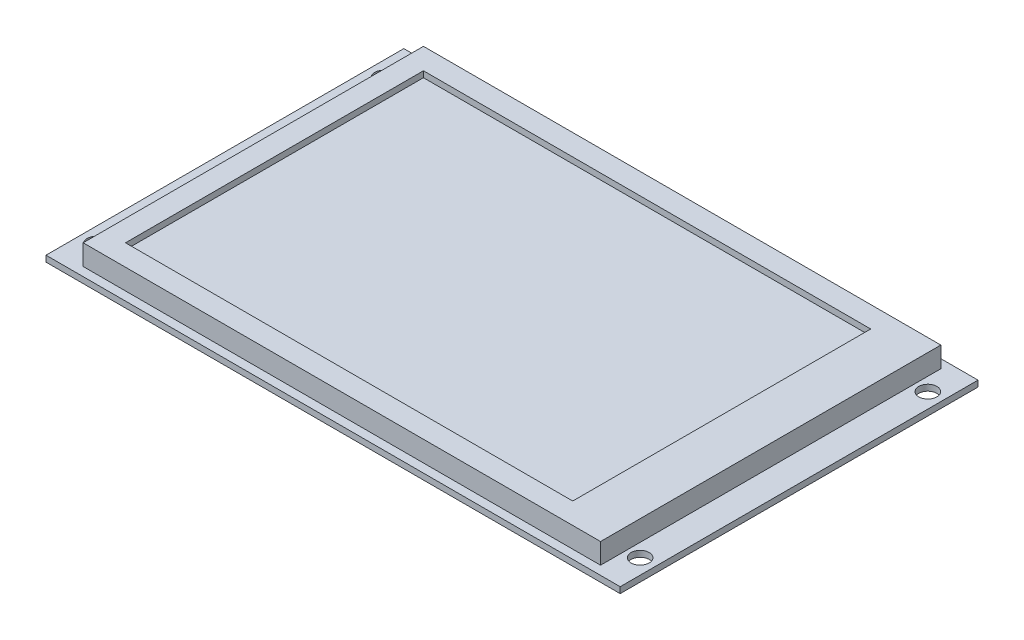
from build123d import *

# Parameters (mm, degrees)
CROQUIS1_W              = 95
CROQUIS1_H              = 59.2
SALIENTE_EXTRUIR1_DEPTH = 1
CROQUIS2_W              = 85.6
CROQUIS2_H              = 56.3
SALIENTE_EXTRUIR2_DEPTH = 3.4
CROQUIS3_W              = 74
CROQUIS3_H              = 49.3
CORTAR_EXTRUIR1_DEPTH   = 1
CROQUIS4_R              = 1.5
CORTAR_EXTRUIR2_DEPTH   = 11
CROQUIS5_R              = 0.5
CORTAR_EXTRUIR3_DEPTH   = 10


with BuildPart() as part:
    # Croquis1 → Saliente-Extruir1 (new body)
    with BuildSketch(Plane(origin=(0, 0, 0), x_dir=(1, 0, 0), z_dir=(0, 1, 0))):
        Rectangle(CROQUIS1_W, CROQUIS1_H)
    extrude(amount=SALIENTE_EXTRUIR1_DEPTH)

    # Croquis2 → Saliente-Extruir2 (add)
    with BuildSketch(Plane(origin=(0, 1, 0), x_dir=(1, 0, 0), z_dir=(0, 1, 0))):
        Rectangle(CROQUIS2_W, CROQUIS2_H)
    extrude(amount=SALIENTE_EXTRUIR2_DEPTH)

    # Croquis3 → Cortar-Extruir1 (cut)
    with BuildSketch(Plane(origin=(0, 4.4, 0), x_dir=(1, 0, 0), z_dir=(0, 1, 0))):
        with Locations((-2.3, 0)):
            Rectangle(CROQUIS3_W, CROQUIS3_H)
    extrude(amount=-CORTAR_EXTRUIR1_DEPTH, mode=Mode.SUBTRACT)

    # Croquis4 → Cortar-Extruir2 (cut)
    with BuildSketch(Plane(origin=(0, 1, 0), x_dir=(1, 0, 0), z_dir=(0, 1, 0))):
        with Locations(Location((45, -23.8, 0), (0, 0, 270))):
            Circle(CROQUIS4_R)
        with Locations(Location((45, 23.8, 0), (0, 0, 90))):
            Circle(CROQUIS4_R)
        with Locations(Location((-45, -23.8, 0), (0, 0, 90))):
            Circle(CROQUIS4_R)
        with Locations(Location((-45, 23.8, 0), (0, 0, 270))):
            Circle(CROQUIS4_R)
    extrude(amount=-CORTAR_EXTRUIR2_DEPTH, mode=Mode.SUBTRACT)

    # Croquis5 → Cortar-Extruir3 (cut)
    with BuildSketch(Plane(origin=(0, 1, 0), x_dir=(1, 0, 0), z_dir=(0, 1, 0))):
        with Locations(Location((-45.35, -9.63, 0), (0, 0, 270))):
            Circle(CROQUIS5_R)
        with Locations(Location((-45.35, -7.09, 0), (0, 0, 270))):
            Circle(CROQUIS5_R)
        with Locations(Location((-45.35, -4.55, 0), (0, 0, 270))):
            Circle(CROQUIS5_R)
        with Locations(Location((-45.35, -2.01, 0), (0, 0, 270))):
            Circle(CROQUIS5_R)
        with Locations(Location((-45.35, 0.53, 0), (0, 0, 270))):
            Circle(CROQUIS5_R)
        with Locations(Location((-45.35, 3.07, 0), (0, 0, 270))):
            Circle(CROQUIS5_R)
        with Locations(Location((-45.35, 5.61, 0), (0, 0, 270))):
            Circle(CROQUIS5_R)
        with Locations(Location((-45.35, 8.15, 0), (0, 0, 270))):
            Circle(CROQUIS5_R)
        with Locations(Location((-45.35, 10.69, 0), (0, 0, 270))):
            Circle(CROQUIS5_R)
    extrude(amount=-CORTAR_EXTRUIR3_DEPTH, mode=Mode.SUBTRACT)


solid = part.part
